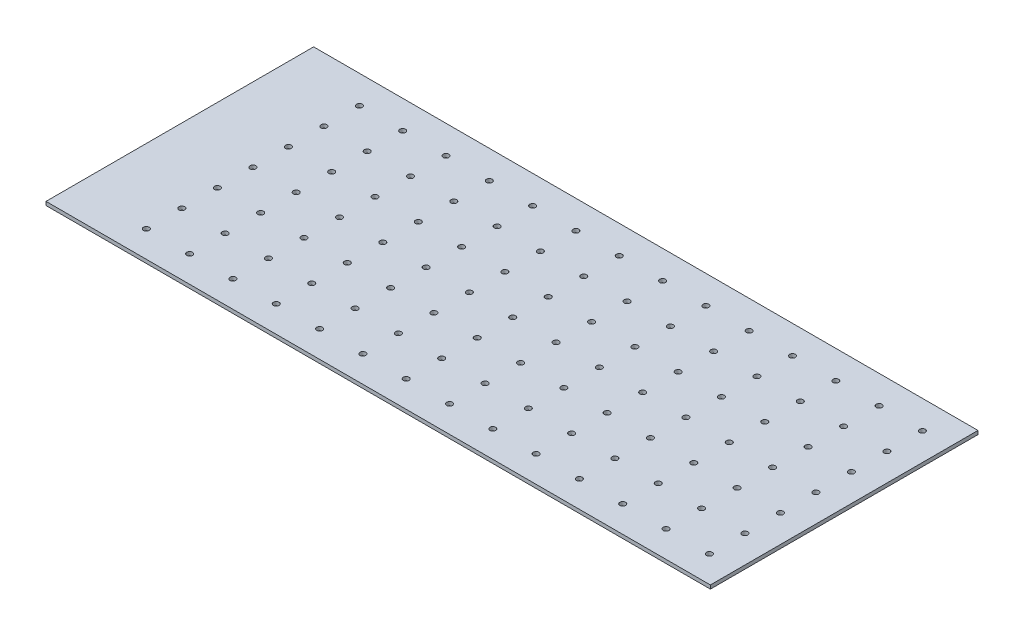
from build123d import *

# Parameters (mm, degrees)
SKETCH1_W            = 540
SKETCH1_H            = 233.64
BOSS_EXTRUDE1_DEPTH  = 3.18
CUT_EXTRUDE1_REACH   = 296.206
SKETCH2_R            = 2.5
LPATTERN1_COUNT      = 14
LPATTERN1_PITCH      = 37.81
LPATTERN1_COUNT_DIR2 = 7
LPATTERN1_PITCH_DIR2 = 31
SKETCH4_W            = 233.64
SKETCH4_H            = 3.18
BOSS_EXTRUDE2_DEPTH  = 40


with BuildPart() as part:
    # Sketch1 → Boss-Extrude1 (new body)
    with BuildSketch(Plane(origin=(0, 0, 0), x_dir=(1, 0, 0), z_dir=(0, 1, 0))):
        Rectangle(SKETCH1_W, SKETCH1_H)
    extrude(amount=BOSS_EXTRUDE1_DEPTH)

    # Sketch2 → Cut-Extrude1 (cut, up to next)
    with BuildSketch(Plane(origin=(0, 3.18, 0), x_dir=(1, 0, 0), z_dir=(0, 1, 0)), mode=Mode.PRIVATE) as cut_extrude1_sk1:
        with Locations(Location((-245.45, 92.22, 0), (0, 0, 270))):
            Circle(SKETCH2_R)
    cut_extrude1_tool1 = extrude(cut_extrude1_sk1.sketch, amount=-CUT_EXTRUDE1_REACH, mode=Mode.PRIVATE) & part.part
    cut_extrude1 = cut_extrude1_tool1.solids().sort_by_distance((-245.45, 3.18, -92.22))[0]
    add(cut_extrude1, mode=Mode.SUBTRACT)

    # LPattern1: Cut-Extrude1 14 × 7
    with Locations(*[(i * LPATTERN1_PITCH, 0, j * LPATTERN1_PITCH_DIR2) for i in range(LPATTERN1_COUNT) for j in range(LPATTERN1_COUNT_DIR2) if (i, j) != (0, 0)]):
        add(cut_extrude1, mode=Mode.SUBTRACT)

    # Sketch4 → Boss-Extrude2 (add)
    with BuildSketch(Plane.ZY.offset(270)):
        with Locations((0, 1.59)):
            Rectangle(SKETCH4_W, SKETCH4_H)
    extrude(amount=BOSS_EXTRUDE2_DEPTH)


solid = part.part
